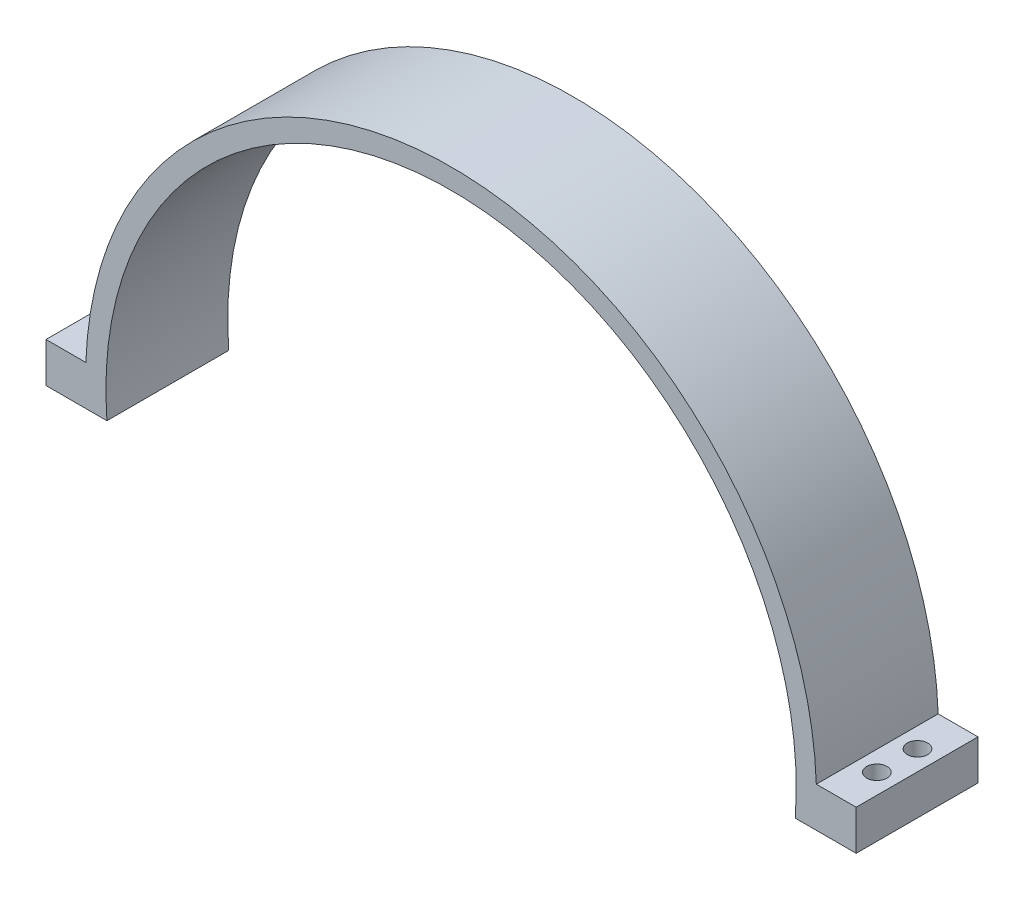
from build123d import *

# Parameters (mm, degrees)
BOSS_EXTRUDE1_DEPTH = 30
SKETCH2_R           = 2.5
CUT_EXTRUDE1_DEPTH  = 30


with BuildPart() as part:
    # Sketch1 → Boss-Extrude1 (new body)
    with BuildSketch(Plane.XY):
        with BuildLine():
            Line((89.939128799, 3.309548431), (99.749159056, 3.309548431))
            Line((99.749159056, 3.309548431), (99.749159056, -6.52533825))
            Line((99.749159056, -6.52533825), (84.749159056, -6.52533825))
            ThreePointArc((84.749159056, -6.52533825), (0, 85), (-84.749159056, -6.52533825))
            Line((-84.749159056, -6.52533825), (-99.749159056, -6.52533825))
            Line((-99.749159056, -6.52533825), (-99.749159056, 3.309548431))
            Line((-99.749159056, 3.309548431), (-89.939128799, 3.309548431))
            ThreePointArc((-89.939128799, 3.309548431), (0, 90), (89.939128799, 3.309548431))
        make_face()
    extrude(amount=BOSS_EXTRUDE1_DEPTH)

    # Sketch2 → Cut-Extrude1 (cut)
    with BuildSketch(Plane(origin=(0, 3.309548431, 0), x_dir=(1, 0, 0), z_dir=(0, 1, 0))):
        with Locations(Location((-94.844143928, -10, 0), (0, 0, 180))):
            Circle(SKETCH2_R)
        with Locations(Location((-94.844143928, -20, 0), (0, 0, 180))):
            Circle(SKETCH2_R)
        with Locations(Location((94.844143928, -20, 0), (0, 0, 180))):
            Circle(SKETCH2_R)
        with Locations(Location((94.844143928, -10, 0), (0, 0, 180))):
            Circle(SKETCH2_R)
    extrude(amount=-CUT_EXTRUDE1_DEPTH, mode=Mode.SUBTRACT)


solid = part.part
